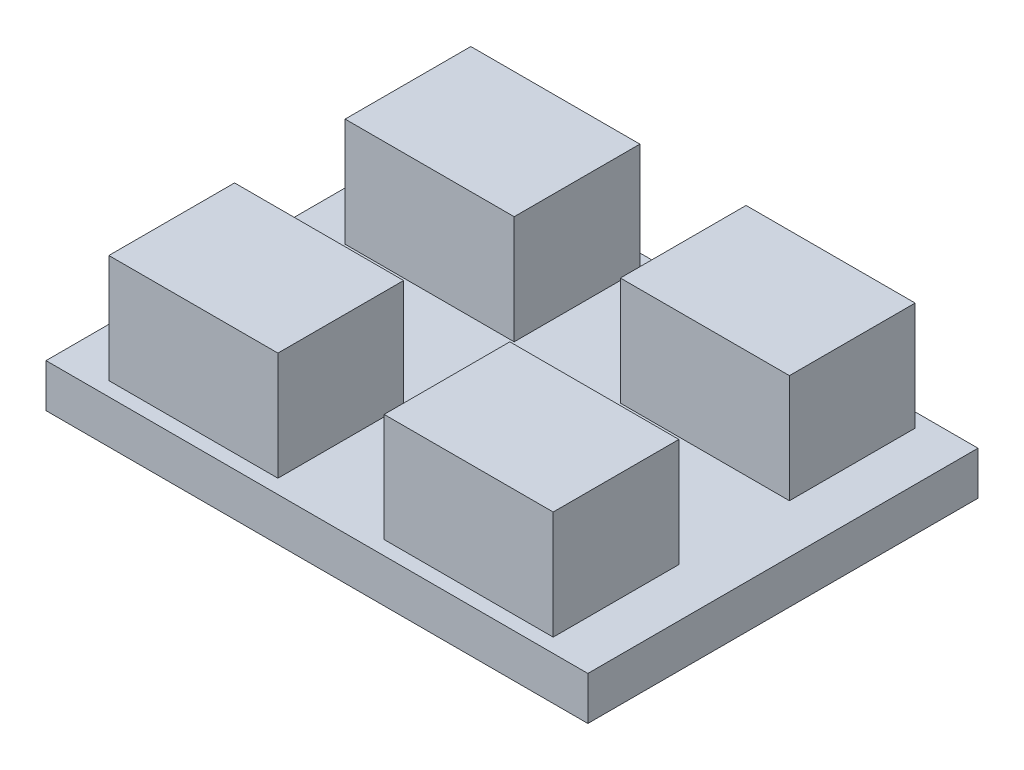
from build123d import *

# Parameters (mm, degrees)
SKETCH_1_W      = 25
SKETCH_1_H      = 18
EXTRUDE_1_DEPTH = 2
SKETCH_2_W      = 7.8
SKETCH_2_H      = 5.8
EXTRUDE_2_DEPTH = 5


with BuildPart() as part:
    # Эскиз1 → Бобышка-Вытянуть1 (new body)
    with BuildSketch(Plane(origin=(0, 0, 0), x_dir=(1, 0, 0), z_dir=(0, 1, 0))):
        Rectangle(SKETCH_1_W, SKETCH_1_H)
    extrude(amount=EXTRUDE_1_DEPTH)

    # Эскиз2 → Бобышка-Вытянуть2 (add)
    with BuildSketch(Plane(origin=(0, 2, 0), x_dir=(1, 0, 0), z_dir=(0, 1, 0))):
        with Locations((6.35, 5.45)):
            Rectangle(SKETCH_2_W, SKETCH_2_H)
        with Locations((-6.35, 5.45)):
            Rectangle(SKETCH_2_W, SKETCH_2_H)
        with Locations((6.35, -5.45)):
            Rectangle(SKETCH_2_W, SKETCH_2_H)
        with Locations((-6.35, -5.45)):
            Rectangle(SKETCH_2_W, SKETCH_2_H)
    extrude(amount=EXTRUDE_2_DEPTH)


solid = part.part
